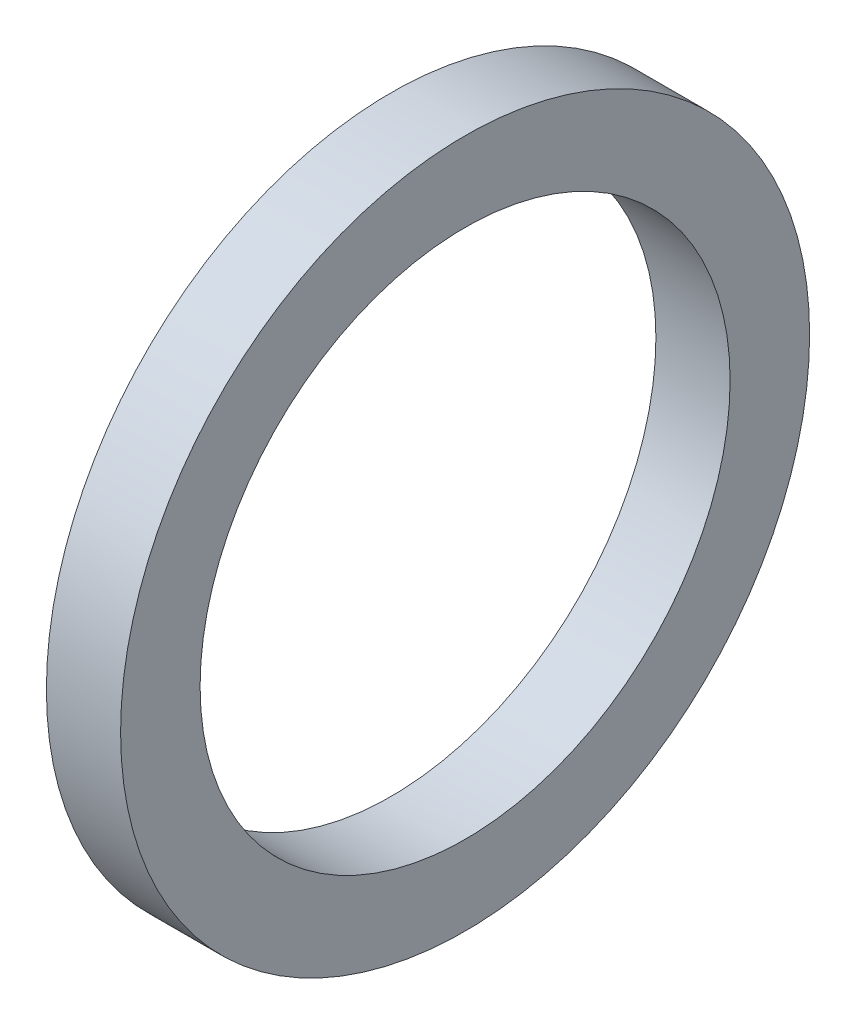
from build123d import *

# Parameters (mm, degrees)
SKETCH_1_R      = 32.5
SKETCH_1_R_2    = 25
EXTRUDE_1_DEPTH = 7


with BuildPart() as part:
    # 草图1 → 凸台-拉伸1 (new body)
    with BuildSketch(Plane(origin=(0, 0, 0), x_dir=(0, 0, -1), z_dir=(1, 0, 0))):
        Circle(SKETCH_1_R)
        Circle(SKETCH_1_R_2, mode=Mode.SUBTRACT)
    extrude(amount=EXTRUDE_1_DEPTH)


solid = part.part
